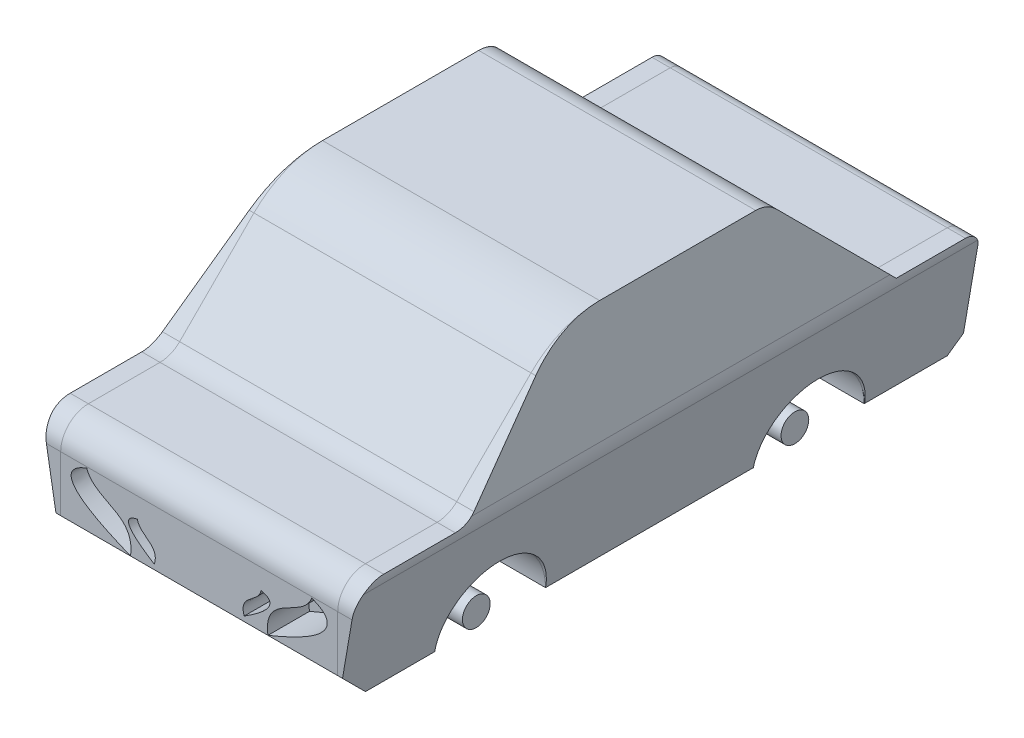
from build123d import *

# Parameters (mm, degrees)
BOSS_EXTRUDE1_DEPTH     = 1000
FILLET1_R               = 700
FILLET2_R               = 200
FILLET3_R               = 200
FILLET4_R               = 200
CHAMFER1_SIZE           = 200
FILLET5_R               = 100
CHAMFER2_SIZE           = 100
CUT_EXTRUDE3_DEPTH      = 400
CUT_EXTRUDE4_START      = -400
CUT_EXTRUDE4_DEPTH      = 400
SKETCH7_R               = 100
BOSS_EXTRUDE2_DEPTH     = 900
CUT_EXTRUDE6_DEPTH      = 300
BOSS_EXTRUDE3_DEPTH     = 4500
BOSS_EXTRUDE3_2_DEPTH   = 4500
CUT_EXTRUDE7_DEPTH      = 3491.640611961
CUT_EXTRUDE7_DEPTH_BACK = 3491.640611961
FILLET6_R               = 300
FILLET7_R               = 300
CUT_EXTRUDE8_DEPTH      = 3489.01206024
CUT_EXTRUDE9_DEPTH      = 3489.01206024


with BuildPart() as part:
    # Car_Profile → Boss-Extrude1 (new, symmetric)
    with BuildSketch(Plane(origin=(0, 0, 0), x_dir=(0, 0, -1), z_dir=(1, 0, 0))):
        Polygon((2250, 0), (2250, 800), (1650, 800), (850, 1600), (-650, 1600), (-1450, 800), (-2250, 800), (-2250, 0), align=None)
    extrude(amount=BOSS_EXTRUDE1_DEPTH, both=True)

    # Fillet1
    fillet1_edges = [part.edges().sort_by_distance(p)[0] for p in [
        (0, 1600, 650),
    ]]
    fillet(fillet1_edges, radius=FILLET1_R)

    # Fillet2
    fillet2_edges = [part.edges().sort_by_distance(p)[0] for p in [
        (0, 1600, -850),
    ]]
    fillet(fillet2_edges, radius=FILLET2_R)

    # Fillet3
    fillet3_edges = [part.edges().sort_by_distance(p)[0] for p in [
        (0, 800, 1450),
    ]]
    fillet(fillet3_edges, radius=FILLET3_R)

    # Fillet4
    fillet4_edges = [part.edges().sort_by_distance(p)[0] for p in [
        (0, 800, 2250),
    ]]
    fillet(fillet4_edges, radius=FILLET4_R)

    # Chamfer1
    chamfer1_edges = [part.edges().sort_by_distance(p)[0] for p in [
        (0, 0, 2250),
    ]]
    chamfer(chamfer1_edges, length=CHAMFER1_SIZE)

    # Fillet5
    fillet5_edges = [part.edges().sort_by_distance(p)[0] for p in [
        (0, 800, -2250),
    ]]
    fillet(fillet5_edges, radius=FILLET5_R)

    # Chamfer2
    chamfer2_edges = [part.edges().sort_by_distance(p)[0] for p in [
        (0, 0, -2250),
    ]]
    chamfer(chamfer2_edges, length=CHAMFER2_SIZE)

    # Sketch4 → Cut-Extrude3 (cut)
    with BuildSketch(Plane(origin=(1000, 0, 0), x_dir=(0, 0, -1), z_dir=(1, 0, 0))):
        with BuildLine():
            Line((-750, 0), (-1550, 0))
            ThreePointArc((-1550, 0), (-1150, 400), (-750, 0))
        make_face()
        with BuildLine():
            Line((750, 0), (1550, 0))
            ThreePointArc((1550, 0), (1150, 400), (750, 0))
        make_face()
    extrude(amount=-CUT_EXTRUDE3_DEPTH, mode=Mode.SUBTRACT)

    # Sketch6 → Cut-Extrude4 (cut)
    with BuildSketch(Plane.ZY.offset(1000).offset(CUT_EXTRUDE4_START)):
        with BuildLine():
            Line((-750, 0), (-1550, 0))
            ThreePointArc((-1550, 0), (-1150, 400), (-750, 0))
        make_face()
        with BuildLine():
            Line((750, 0), (1550, 0))
            ThreePointArc((1550, 0), (1150, 400), (750, 0))
        make_face()
    extrude(amount=CUT_EXTRUDE4_DEPTH, mode=Mode.SUBTRACT)

    # Sketch7 → Boss-Extrude2 (add, symmetric)
    with BuildSketch(Plane(origin=(0, 0, 0), x_dir=(0, 0, -1), z_dir=(1, 0, 0))):
        with Locations((-1150, 0)):
            Circle(SKETCH7_R)
        with Locations((1150, 0)):
            Circle(SKETCH7_R)
    extrude(amount=BOSS_EXTRUDE2_DEPTH, both=True)

    # Sketch3 → Cut-Extrude6 (cut)
    with BuildSketch(Plane.XY.offset(2250)):
        with BuildLine():
            add(Edge.make_bspline(
                [(-812.220424377, 592.068401543), (-750.671179112, 420.314312551), (-457.577758575, 466.704189274), (-496.056589451, 200)],
                knots=[0, 0, 0, 0, 1, 1, 1, 1], degree=3))
            add(Edge.make_bspline(
                [(-812.220424377, 592.068401543), (-1175.602480819, 453.360293498), (-543.357650564, 223.458106016), (-496.056589451, 200)],
                knots=[0, 0, 0, 0, 1, 1, 1, 1], degree=3))
        make_face()
        with BuildLine():
            add(Edge.make_bspline(
                [(-446.096477938, 455.326051812), (-637.070416277, 418.575957657), (-345.711658908, 250.477148017), (-324.457161733, 234.819414147)],
                knots=[0, 0, 0, 0, 1, 1, 1, 1], degree=3))
            add(Edge.make_bspline(
                [(-446.096477938, 455.326051812), (-430.701783253, 365.409715448), (-282.353688025, 362.804701396), (-324.457161733, 234.819414147)],
                knots=[0, 0, 0, 0, 1, 1, 1, 1], degree=3))
        make_face()
        with BuildLine():
            add(Edge.make_bspline(
                [(446.096477938, 455.326051812), (430.701783253, 365.409715448), (282.353688025, 362.804701396), (324.457161733, 234.819414147)],
                knots=[0, 0, 0, 0, 1, 1, 1, 1], degree=3))
            add(Edge.make_bspline(
                [(446.096477938, 455.326051812), (637.070416277, 418.575957657), (345.711658908, 250.477148017), (324.457161733, 234.819414147)],
                knots=[0, 0, 0, 0, 1, 1, 1, 1], degree=3))
        make_face()
        with BuildLine():
            add(Edge.make_bspline(
                [(812.220424377, 592.068401543), (1175.602480819, 453.360293498), (543.357650564, 223.458106016), (496.056589451, 200)],
                knots=[0, 0, 0, 0, 1, 1, 1, 1], degree=3))
            add(Edge.make_bspline(
                [(812.220424377, 592.068401543), (750.671179112, 420.314312551), (457.577758575, 466.704189274), (496.056589451, 200)],
                knots=[0, 0, 0, 0, 1, 1, 1, 1], degree=3))
        make_face()
    extrude(amount=-CUT_EXTRUDE6_DEPTH, mode=Mode.SUBTRACT)


with BuildPart() as body_2:
    # Sketch8 → Boss-Extrude3 (new body)
    with BuildSketch(Plane.XY.offset(2250)):
        Polygon((-1000, 0), (-1000, 1600), (-1135.900718999, 790.482834849), align=None)
    extrude(amount=-BOSS_EXTRUDE3_DEPTH)


with BuildPart() as body_3:
    # Sketch8 → Boss-Extrude3 2 (new body)
    with BuildSketch(Plane.XY.offset(2250)):
        Polygon((1000, 1600), (1135.900718999, 790.482834849), (1000, 0), align=None)
    extrude(amount=-BOSS_EXTRUDE3_2_DEPTH)


with BuildPart() as cut_extrude7_tool:
    # Sketch9 → Cut-Extrude7 (new, two sides: drawn at the far end of the back side and taken through both)
    with BuildSketch(Plane.ZY.offset(-1000).offset(-CUT_EXTRUDE7_DEPTH_BACK)):
        with BuildLine():
            Line((-2250, 700), (-2250, 1600))
            Line((-2250, 1600), (-767.157287525, 1600))
            ThreePointArc((-767.157287525, 1600), (-843.693973998, 1584.775906502), (-908.578643763, 1541.421356237))
            Line((-908.578643763, 1541.421356237), (-1650, 800))
            Line((-1650, 800), (-2150, 800))
            ThreePointArc((-2150, 800), (-2220.710678119, 770.710678119), (-2250, 700))
        make_face()
        with BuildLine():
            Line((2050, 800), (1532.842712475, 800))
            ThreePointArc((1532.842712475, 800), (1456.306026002, 815.224093498), (1391.421356237, 858.578643763))
            Line((1391.421356237, 858.578643763), (855.025253169, 1394.974746831))
            ThreePointArc((855.025253169, 1394.974746831), (627.928908994, 1546.715672758), (360.050506339, 1600))
            Line((360.050506339, 1600), (2250, 1600))
            Line((2250, 1600), (2250, 600))
            ThreePointArc((2250, 600), (2191.421356237, 741.421356237), (2050, 800))
        make_face()
        Polygon((2250, 200), (2050, 0), (2250, 0), align=None)
        Polygon((-2250, 100), (-2250, 0), (-2150, 0), align=None)
    extrude(amount=CUT_EXTRUDE7_DEPTH + CUT_EXTRUDE7_DEPTH_BACK)


with BuildPart() as body_2_1:
    add(body_2.part)

    # Cut-Extrude7: cut by cut_extrude7_tool
    add(cut_extrude7_tool.part, mode=Mode.SUBTRACT)

    # Fillet6
    fillet6_edges = [body_2_1.edges().sort_by_distance(p)[0] for p in [
        (-1135.900718999, 790.482834849, -40.808137785),
    ]]
    fillet(fillet6_edges, radius=FILLET6_R)

    # Sketch10 → Cut-Extrude8 (cut, through all)
    with BuildSketch(Plane(origin=(-1000, 0, 0), x_dir=(0, 0, -1), z_dir=(1, 0, 0))):
        with BuildLine():
            Line((-1550, 0), (-750, 0))
            ThreePointArc((-750, 0), (-1150, 400), (-1550, 0))
        make_face()
        with BuildLine():
            Line((1550, 0), (750, 0))
            ThreePointArc((750, 0), (1150, 400), (1550, 0))
        make_face()
    extrude(amount=-CUT_EXTRUDE8_DEPTH, mode=Mode.SUBTRACT)


with BuildPart() as body_3_1:
    add(body_3.part)

    # Cut-Extrude7: cut by cut_extrude7_tool
    add(cut_extrude7_tool.part, mode=Mode.SUBTRACT)

    # Fillet7
    fillet7_edges = [body_3_1.edges().sort_by_distance(p)[0] for p in [
        (1135.900718999, 790.482834849, -40.808137785),
    ]]
    fillet(fillet7_edges, radius=FILLET7_R)

    # Sketch11 → Cut-Extrude9 (cut, through all)
    with BuildSketch(Plane.ZY.offset(-1000)):
        with BuildLine():
            Line((1550, 0), (750, 0))
            ThreePointArc((750, 0), (1150, 400), (1550, 0))
        make_face()
        with BuildLine():
            Line((-750, 0), (-1553.812431016, 0))
            ThreePointArc((-1553.812431016, 0), (-1151.906215508, 387.554495198), (-750, 0))
        make_face()
    extrude(amount=-CUT_EXTRUDE9_DEPTH, mode=Mode.SUBTRACT)


solid = Compound([part.part, body_2_1.part, body_3_1.part])
